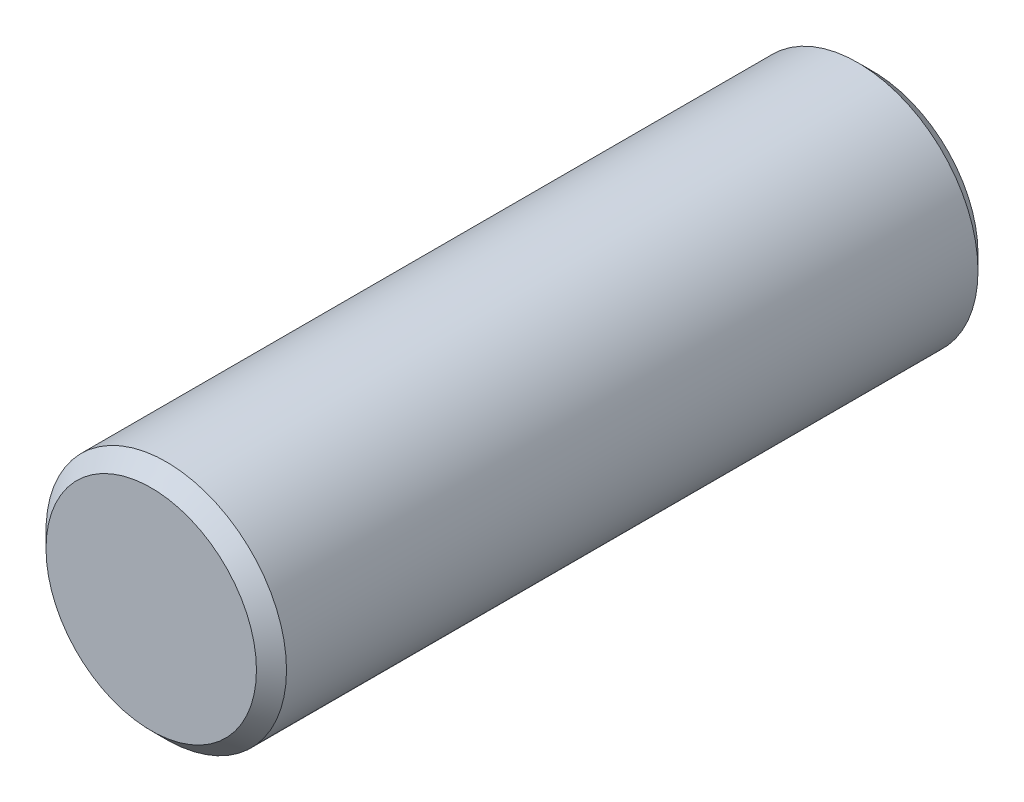
from build123d import *


with BuildPart() as part:
    # Sketch1 → Revolve1 (revolve)
    with BuildSketch(Plane(origin=(0, 0, 0), x_dir=(1, 0, 0), z_dir=(0, 1, 0))):
        Polygon((1.75, 6), (0, 6), (0, -6), (1.75, -6), (2, -5.75), (2, 5.75), align=None)
    revolve(axis=Axis((0, 0, -6), (0, 0, 1)))


solid = part.part
